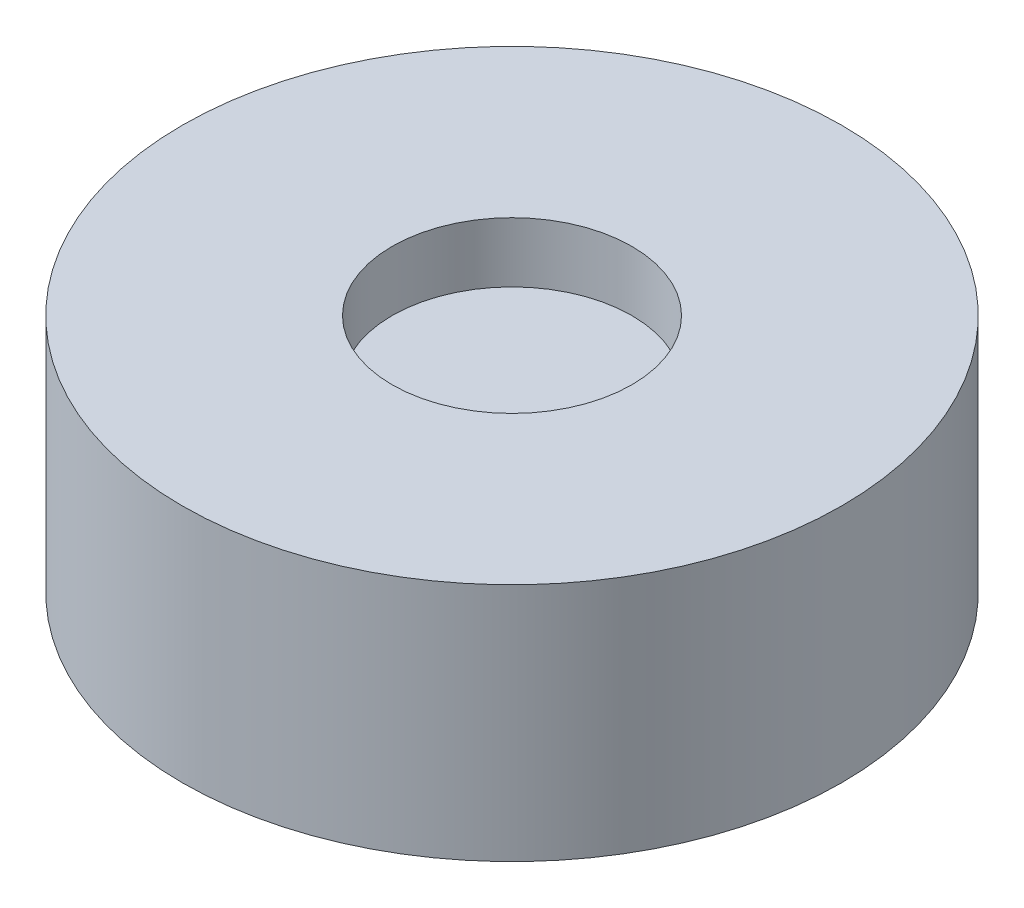
from build123d import *

# Parameters (mm, degrees)
SKETCH1_R           = 5.5
SKETCH1_R_2         = 4.15
BOSS_EXTRUDE1_DEPTH = 3
SKETCH2_R           = 5.5
SKETCH2_R_2         = 2
BOSS_EXTRUDE2_DEPTH = 1
BOSS_EXTRUDE3_START = 1
SKETCH3_R           = 4.15
BOSS_EXTRUDE3_DEPTH = 1


with BuildPart() as part:
    # Sketch1 → Boss-Extrude1 (new body)
    with BuildSketch(Plane(origin=(0, 0, 0), x_dir=(1, 0, 0), z_dir=(0, 1, 0))):
        with Locations(Location((0, 0, 0), (0, 0, 270))):
            Circle(SKETCH1_R)
        with Locations(Location((0, 0, 0), (0, 0, 270))):
            Circle(SKETCH1_R_2, mode=Mode.SUBTRACT)
    extrude(amount=BOSS_EXTRUDE1_DEPTH)

    # Sketch2 → Boss-Extrude2 (add)
    with BuildSketch(Plane(origin=(0, 3, 0), x_dir=(1, 0, 0), z_dir=(0, 1, 0))):
        with Locations(Location((0, 0, 0), (0, 0, 270))):
            Circle(SKETCH2_R)
        with Locations(Location((0, 0, 0), (0, 0, 270))):
            Circle(SKETCH2_R_2, mode=Mode.SUBTRACT)
    extrude(amount=BOSS_EXTRUDE2_DEPTH)

    # Sketch3 → Boss-Extrude3 (add)
    with BuildSketch(Plane.XZ.offset(-3).offset(BOSS_EXTRUDE3_START)):
        with Locations(Location((0, 0, 0), (0, 0, 270))):
            Circle(SKETCH3_R)
    extrude(amount=-BOSS_EXTRUDE3_DEPTH)


solid = part.part
